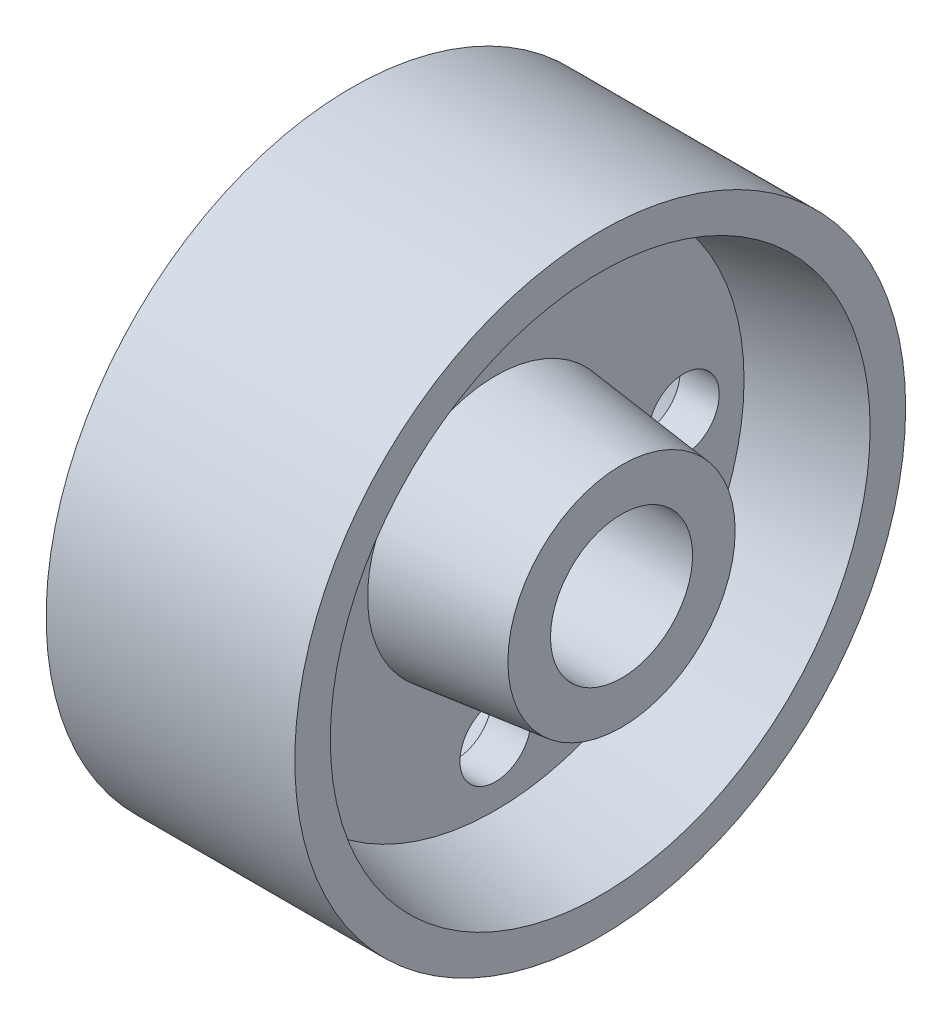
from build123d import *

# Parameters (mm, degrees)
CUT_EXTRUDE1_DEPTH      = 74.341666193
CUT_EXTRUDE1_DEPTH_BACK = 74.341666193
SKETCH4_R               = 5
CUT_EXTRUDE2_DEPTH      = 74.341666193
CUT_EXTRUDE2_DEPTH_BACK = 74.341666193
SKETCH5_R               = 10


with BuildPart() as part:
    # Sketch1 → Revolve1 (revolve)
    with BuildSketch(Plane(origin=(0, 0, 0), x_dir=(1, 0, 0), z_dir=(0, 1, 0))):
        Polygon((20.5, 0), (-20.5, 0), (-20.5, 16), (-2.75, 18), (-2.75, 35), (-17.5, 38), (-17.5, 43), (17.5, 43), (17.5, 38), (2.75, 35), (2.75, 18), (20.5, 16), align=None)
    revolve(axis=Axis((20.5, 0, 0), (-1, 0, 0)))

    # Sketch4 → Cut-Extrude1 (cut, two sides: drawn at the far end of the back side and taken through both)
    with BuildSketch(Plane.ZY.offset(20.5).offset(-CUT_EXTRUDE1_DEPTH_BACK)):
        with Locations((0, 26.5)):
            Circle(SKETCH4_R)
        with Locations((26.5, 0)):
            Circle(SKETCH4_R)
        with Locations((0, -26.5)):
            Circle(SKETCH4_R)
        with Locations((-26.5, 0)):
            Circle(SKETCH4_R)
    extrude(amount=CUT_EXTRUDE1_DEPTH + CUT_EXTRUDE1_DEPTH_BACK, mode=Mode.SUBTRACT)

    # Sketch5 → Cut-Extrude2 (cut, two sides: drawn at the far end of the back side and taken through both)
    with BuildSketch(Plane.ZY.offset(20.5).offset(-CUT_EXTRUDE2_DEPTH_BACK)):
        Circle(SKETCH5_R)
    extrude(amount=CUT_EXTRUDE2_DEPTH + CUT_EXTRUDE2_DEPTH_BACK, mode=Mode.SUBTRACT)


solid = part.part
